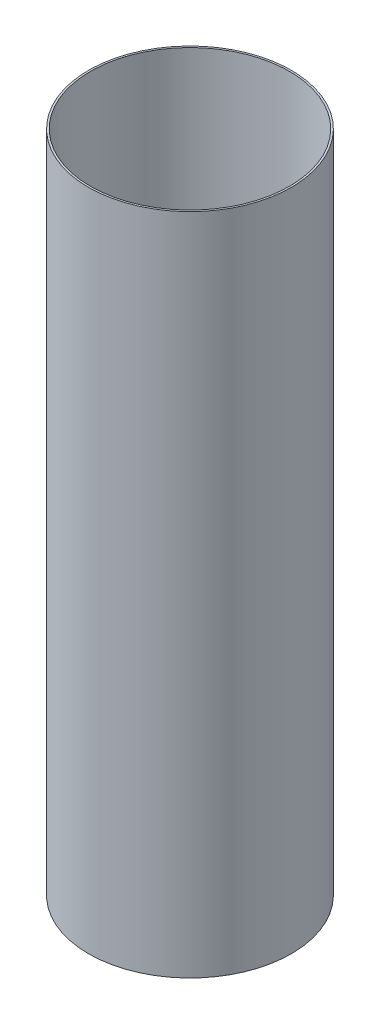
from build123d import *

# Parameters (mm, degrees)
SKETCH1_R           = 77.6224
SKETCH1_R_2         = 76.2
BOSS_EXTRUDE1_DEPTH = 254


with BuildPart() as part:
    # Sketch1 → Boss-Extrude1 (new, symmetric)
    with BuildSketch(Plane(origin=(0, 0, 0), x_dir=(1, 0, 0), z_dir=(0, 1, 0))):
        with Locations(Location((0, 0, 0), (0, 0, 270))):
            Circle(SKETCH1_R)
        with Locations(Location((0, 0, 0), (0, 0, 270))):
            Circle(SKETCH1_R_2, mode=Mode.SUBTRACT)
    extrude(amount=BOSS_EXTRUDE1_DEPTH, both=True)


solid = part.part
